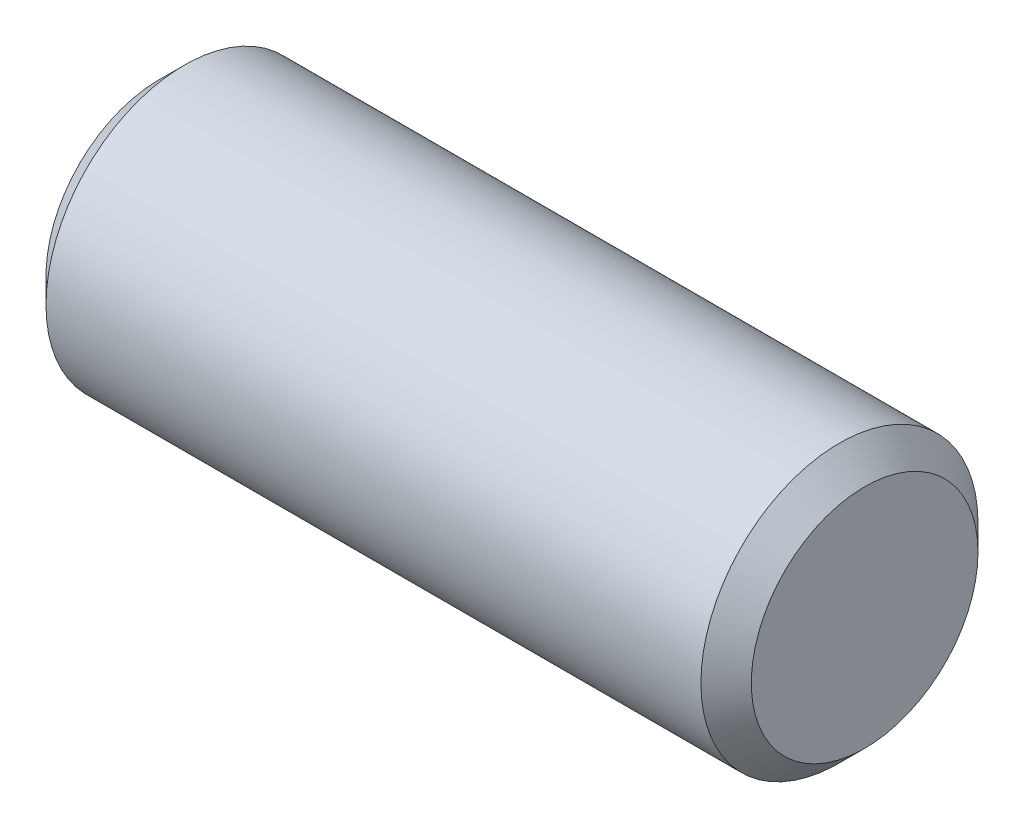
from build123d import *


with BuildPart() as part:
    # Эскиз1 → Повернуть1 (revolve)
    with BuildSketch(Plane.XY, mode=Mode.PRIVATE) as revolve_1_sk:
        Polygon((0, 0), (0, 9), (-2, 11), (-54, 11), (-56, 9), (-56, 0), align=None)
    revolve(revolve_1_sk.sketch.rotate(Axis((0, 0, 0), (-1, 0, 0)), 90), axis=Axis((0, 0, 0), (-1, 0, 0)))


solid = part.part
